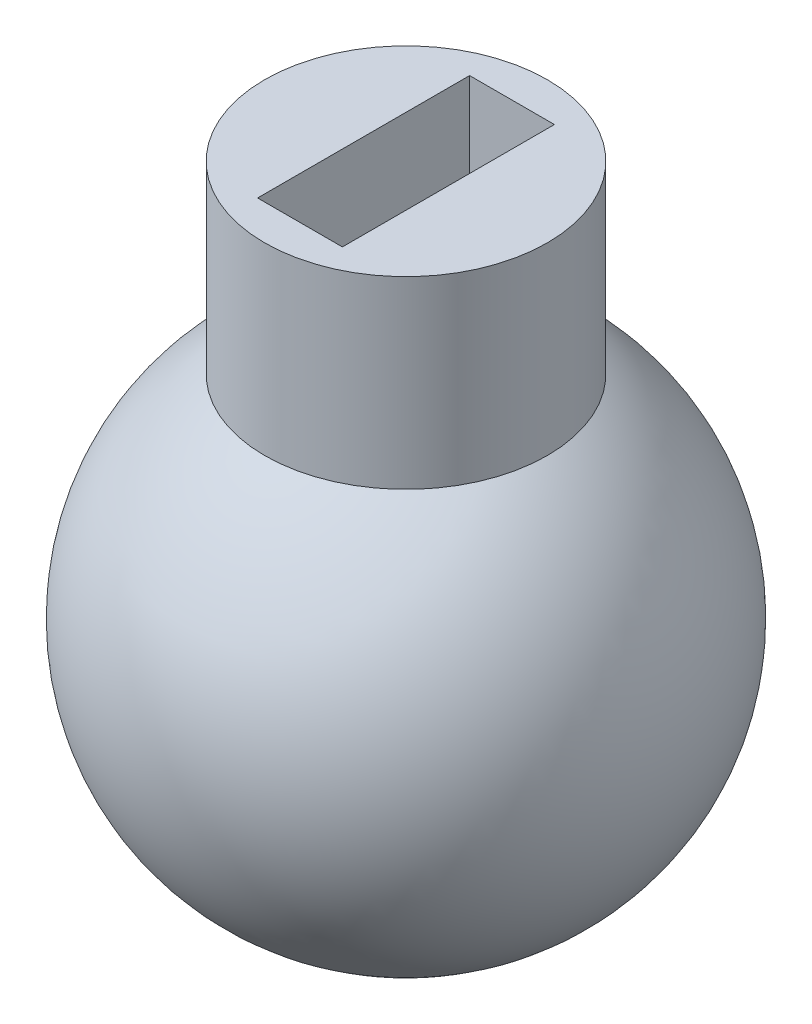
from build123d import *

# Parameters (mm, degrees)
SKETCH_2_W          = 6
SKETCH_2_H          = 15
CUT_EXTRUDE_1_DEPTH = 24


with BuildPart() as part:
    # 草图1 → 旋转1 (revolve)
    with BuildSketch(Plane.XY, mode=Mode.PRIVATE) as revolve_1_sk:
        with BuildLine():
            Line((-10, 28), (-10, 14.966629547))
            ThreePointArc((-10, 14.966629547), (-17.22497216, -5.22497216), (0, -18))
            Line((0, -18), (0, 28))
            Line((0, 28), (-10, 28))
        make_face()
    revolve(revolve_1_sk.sketch.rotate(Axis((0, 81.279546427, 0), (0, -1, 0)), 270), axis=Axis((0, 81.279546427, 0), (0, -1, 0)))

    # 草图2 → 切除-拉伸1 (cut)
    with BuildSketch(Plane(origin=(0, 28, 0), x_dir=(1, 0, 0), z_dir=(0, 1, 0))):
        Rectangle(SKETCH_2_W, SKETCH_2_H)
    extrude(amount=-CUT_EXTRUDE_1_DEPTH, mode=Mode.SUBTRACT)


solid = part.part
